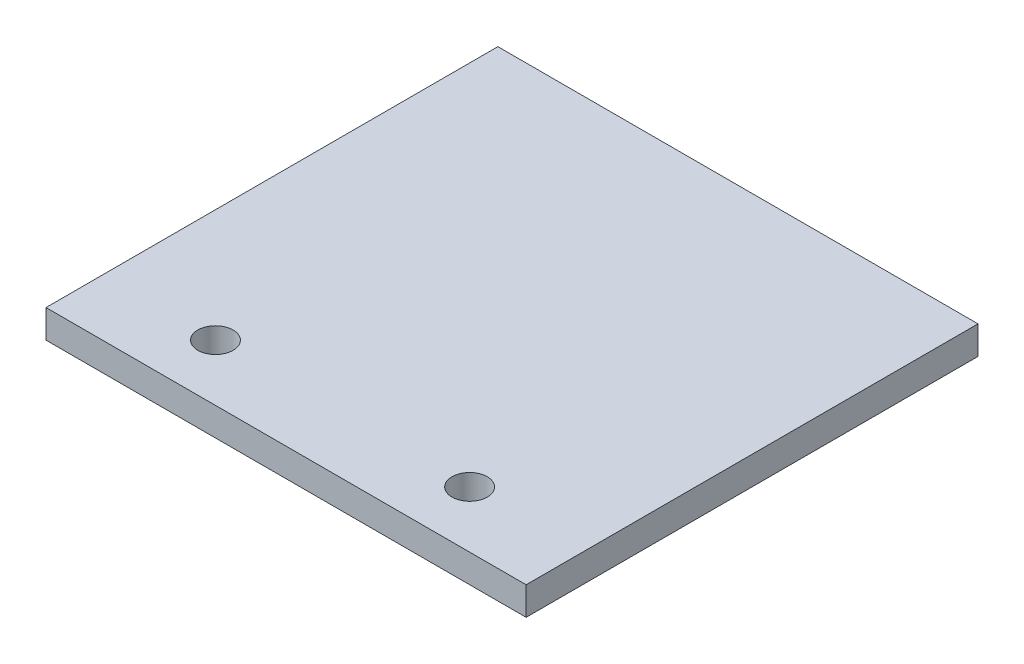
from build123d import *

# Parameters (mm, degrees)
SKETCH1_W           = 107.95
SKETCH1_H           = 101.6
BOSS_EXTRUDE1_DEPTH = 6.35
CUT_EXTRUDE1_REACH  = 76.393
SKETCH2_R           = 3.96875


with BuildPart() as part:
    # Sketch1 → Boss-Extrude1 (new body)
    with BuildSketch(Plane(origin=(0, 0, 0), x_dir=(1, 0, 0), z_dir=(0, 1, 0))):
        Rectangle(SKETCH1_W, SKETCH1_H)
    extrude(amount=BOSS_EXTRUDE1_DEPTH)

    # Sketch2 → Cut-Extrude1 (cut, up to next)
    with BuildSketch(Plane(origin=(0, 6.35, 0), x_dir=(1, 0, 0), z_dir=(0, 1, 0)), mode=Mode.PRIVATE) as cut_extrude1_sk1:
        with Locations(Location((-28.575, -38.1, 0), (0, 0, 270))):
            Circle(SKETCH2_R)
    cut_extrude1_tool1 = extrude(cut_extrude1_sk1.sketch, amount=-CUT_EXTRUDE1_REACH, mode=Mode.PRIVATE) & part.part
    # Sketch2 → Cut-Extrude1 (cut, up to next)
    with BuildSketch(Plane(origin=(0, 6.35, 0), x_dir=(1, 0, 0), z_dir=(0, 1, 0)), mode=Mode.PRIVATE) as cut_extrude1_sk2:
        with Locations(Location((28.575, -38.1, 0), (0, 0, 270))):
            Circle(SKETCH2_R)
    cut_extrude1_tool2 = extrude(cut_extrude1_sk2.sketch, amount=-CUT_EXTRUDE1_REACH, mode=Mode.PRIVATE) & part.part
    add(cut_extrude1_tool1.solids().sort_by_distance((-28.575, 6.35, 38.1))[0], mode=Mode.SUBTRACT)
    add(cut_extrude1_tool2.solids().sort_by_distance((28.575, 6.35, 38.1))[0], mode=Mode.SUBTRACT)


solid = part.part
